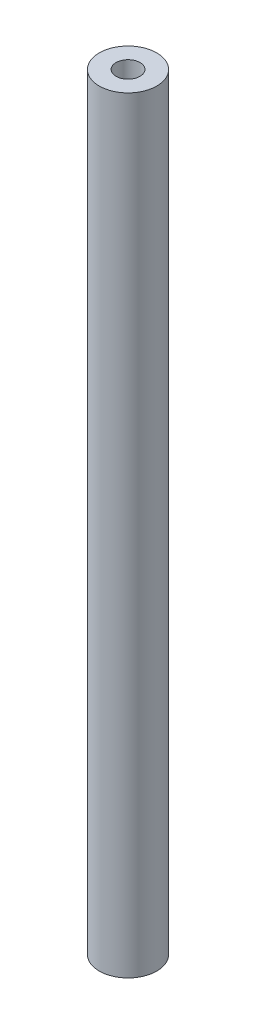
from build123d import *

# Parameters (mm, degrees)
SKETCH1_R           = 45.72
BOSS_EXTRUDE1_DEPTH = 1219.2
SKETCH2_R           = 19.05
CUT_EXTRUDE1_DEPTH  = 1221.913296184


with BuildPart() as part:
    # Sketch1 → Boss-Extrude1 (new body)
    with BuildSketch(Plane(origin=(0, 0, 0), x_dir=(1, 0, 0), z_dir=(0, 1, 0))):
        with Locations(Location((0, 0, 0), (0, 0, 90))):
            Circle(SKETCH1_R)
    extrude(amount=BOSS_EXTRUDE1_DEPTH)

    # Sketch2 → Cut-Extrude1 (cut, through all)
    with BuildSketch(Plane(origin=(0, 1219.2, 0), x_dir=(1, 0, 0), z_dir=(0, 1, 0))):
        with Locations(Location((0, 0, 0), (0, 0, 270))):
            Circle(SKETCH2_R)
    extrude(amount=-CUT_EXTRUDE1_DEPTH, mode=Mode.SUBTRACT)


solid = part.part
